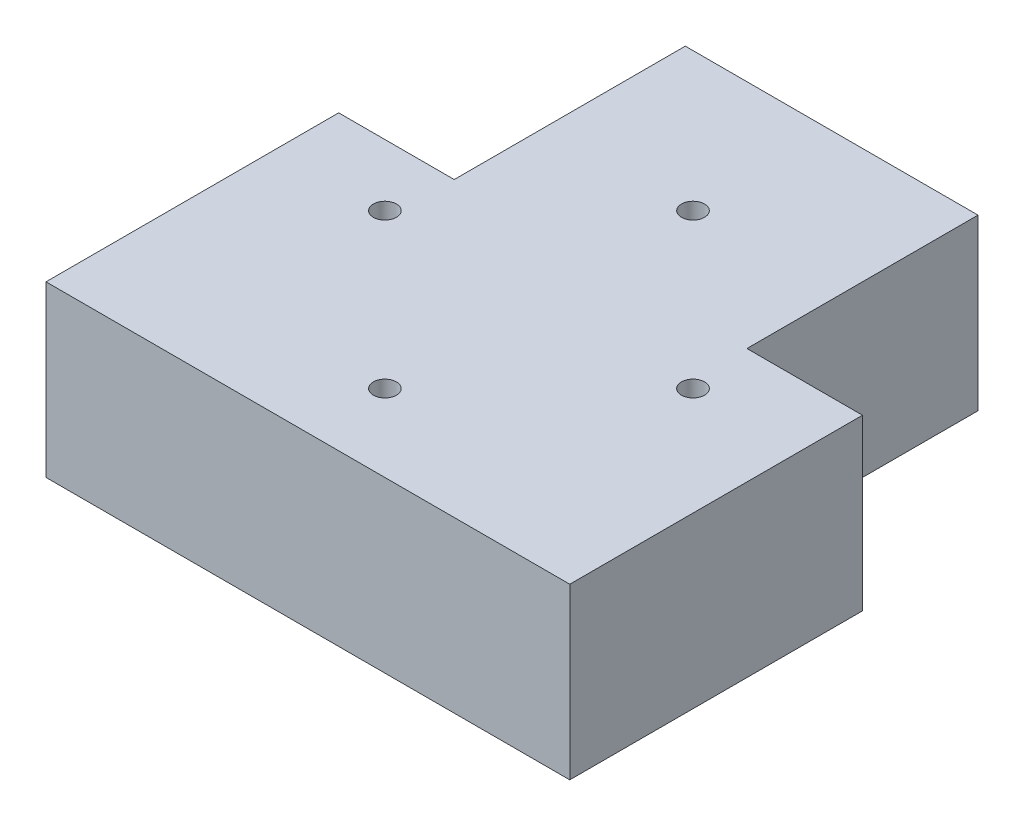
from build123d import *

# Parameters (mm, degrees)
CROQUIS3_R               = 11
SALIENTE_EXTRUIR1_DEPTH  = 6
CROQUIS5_R               = 1.7
CORTAR_EXTRUIR2_DEPTH    = 62.100641025
SALIENTE_EXTRUIR2_START  = -6
CROQUIS6_R               = 11
CROQUIS6_R_2             = 10.875
SALIENTE_EXTRUIR2_DEPTH  = 6
SALIENTE_EXTRUIR3_START  = -6
CROQUIS7_R               = 10.875
SALIENTE_EXTRUIR3_DEPTH  = 6
CROQUIS8_W               = 68
CROQUIS8_H               = 4
SALIENTE_EXTRUIR5_DEPTH  = 6
CROQUIS9_W               = 88.033568274
CROQUIS9_H               = 18.476688198
CORTAR_EXTRUIR3_DEPTH    = 6
CROQUIS10_W              = 21.550300015
CROQUIS10_H              = 64
CORTAR_EXTRUIR4_DEPTH    = 6
CROQUIS11_W              = 19.085610936
CROQUIS11_H              = 64
CORTAR_EXTRUIR5_DEPTH    = 6
CROQUIS12_W              = 103.706532793
CROQUIS12_H              = 25.59484813
CORTAR_EXTRUIR6_DEPTH    = 6
SALIENTE_EXTRUIR7_DEPTH  = 6
SALIENTE_EXTRUIR8_START  = -6
SALIENTE_EXTRUIR8_DEPTH  = 6
CROQUIS15_W              = 68
CROQUIS15_H              = 3
CORTAR_EXTRUIR7_DEPTH    = 90
SALIENTE_EXTRUIR9_DEPTH  = 15
CROQUIS17_W              = 15
CROQUIS17_H              = 30
CORTAR_EXTRUIR8_DEPTH    = 15
CROQUIS18_W              = 23.220677269
CROQUIS18_H              = 33.839021269
CORTAR_EXTRUIR10_DEPTH   = 15
CROQUIS19_R              = 1.5
SALIENTE_EXTRUIR10_DEPTH = 4
CROQUIS20_R              = 2.75
CORTAR_EXTRUIR12_DEPTH   = 4


with BuildPart() as part:
    # Croquis3 → Saliente-Extruir1 (new body)
    with BuildSketch(Plane(origin=(0, 0, 0), x_dir=(1, 0, 0), z_dir=(0, 1, 0))):
        with BuildLine():
            ThreePointArc((-42.801000552, 4.132112265), (-40.664966724, 3.179307113), (-38.41511618, 2.540049182))
            ThreePointArc((-38.41511618, 2.540049182), (-38.470748704, 1.474616944), (-38.496837459, 0.408052268))
            ThreePointArc((-38.496837459, 0.408052268), (-40.789021211, -0.057105575), (-42.991724013, -0.843603213))
            ThreePointArc((-42.991724013, -0.843603213), (-42.968445785, -1.647017549), (-42.930154943, -2.449856438))
            ThreePointArc((-42.930154943, -2.449856438), (-40.673709502, -3.065431082), (-38.352643988, -3.353759106))
            ThreePointArc((-38.352643988, -3.353759106), (-38.244987054, -4.415197194), (-38.107959725, -5.473244614))
            ThreePointArc((-38.107959725, -5.473244614), (-40.302274043, -6.282851213), (-42.3591038, -7.396372439))
            ThreePointArc((-42.3591038, -7.396372439), (-42.21345776, -8.186817694), (-42.053062888, -8.974402582))
            ThreePointArc((-42.053062888, -8.974402582), (-39.729095003, -9.238318171), (-37.391218326, -9.168958123))
            ThreePointArc((-37.391218326, -9.168958123), (-37.122795321, -10.201522853), (-36.825863714, -11.226253282))
            ThreePointArc((-36.825863714, -11.226253282), (-38.87087573, -12.361332145), (-40.733622096, -13.775776963))
            ThreePointArc((-40.733622096, -13.775776963), (-40.469022063, -14.534725772), (-40.190282682, -15.288596336))
            ThreePointArc((-40.190282682, -15.288596336), (-37.85326419, -15.194666912), (-35.553374199, -14.769244533))
            ThreePointArc((-35.553374199, -14.769244533), (-35.130476731, -15.748733462), (-34.680600669, -16.716128087))
            ThreePointArc((-34.680600669, -16.716128087), (-36.528377035, -18.150073928), (-38.153378814, -19.832288952))
            ThreePointArc((-38.153378814, -19.832288952), (-37.776026789, -20.541952196), (-37.385476313, -21.24443835))
            ThreePointArc((-37.385476313, -21.24443835), (-35.090184947, -20.794865539), (-32.882189114, -20.023352369))
            ThreePointArc((-32.882189114, -20.023352369), (-32.314729541, -20.926807107), (-31.722453739, -21.814191019))
            ThreePointArc((-31.722453739, -21.814191019), (-33.329684142, -23.513393361), (-34.67885267, -25.423948896))
            ThreePointArc((-34.67885267, -25.423948896), (-34.197593465, -26.067692672), (-33.704386066, -26.702328735))
            ThreePointArc((-33.704386066, -26.702328735), (-31.50462151, -25.907650142), (-29.440273385, -24.808129797))
            ThreePointArc((-29.440273385, -24.808129797), (-28.741552479, -25.614374131), (-28.020759379, -26.400947801))
            ThreePointArc((-28.020759379, -26.400947801), (-29.349771703, -28.325578783), (-30.391483612, -30.419693027))
            ThreePointArc((-30.391483612, -30.419693027), (-29.817597534, -30.982428525), (-29.233293577, -31.534339166))
            ThreePointArc((-29.233293577, -31.534339166), (-27.180616447, -30.413181385), (-25.308302601, -29.011425688))
            ThreePointArc((-25.308302601, -29.011425688), (-24.494697787, -29.701561934), (-23.66228217, -30.368888744))
            ThreePointArc((-23.66228217, -30.368888744), (-24.68192549, -32.473836646), (-25.391763937, -34.702425336))
            ThreePointArc((-25.391763937, -34.702425336), (-24.738702389, -35.170962513), (-24.076997462, -35.627211415))
            ThreePointArc((-24.076997462, -35.627211415), (-22.219520771, -34.205853433), (-20.583126654, -32.53471835))
            ThreePointArc((-20.583126654, -32.53471835), (-19.67370814, -33.092570299), (-18.749181121, -33.625008674))
            ThreePointArc((-18.749181121, -33.625008674), (-19.435555863, -35.860935301), (-19.796882836, -38.171762207))
            ThreePointArc((-19.796882836, -38.171762207), (-19.079953028, -38.535118949), (-18.356356934, -38.885012024))
            ThreePointArc((-18.356356934, -38.885012024), (-16.737618362, -37.196769268), (-15.375499664, -35.29542479))
            ThreePointArc((-15.375499664, -35.29542479), (-14.391583449, -35.707916865), (-13.396615158, -36.092986899))
            ThreePointArc((-13.396615158, -36.092986899), (-13.73363328, -38.407484027), (-13.73797958, -40.746385325))
            ThreePointArc((-13.73797958, -40.746385325), (-12.97398574, -40.996044858), (-12.205458958, -41.231380909))
            ThreePointArc((-12.205458958, -41.231380909), (-10.863400364, -39.315824358), (-9.807483994, -37.228836387))
            ThreePointArc((-9.807483994, -37.228836387), (-8.772132239, -37.486300124), (-7.73004389, -37.714976103))
            ThreePointArc((-7.73004389, -37.714976103), (-7.709805972, -40.053793881), (-7.357069727, -42.365947706))
            ThreePointArc((-7.357069727, -42.365947706), (-6.563919221, -42.496058223), (-5.768475368, -42.611321171))
            ThreePointArc((-5.768475368, -42.611321171), (-4.734553468, -40.513349847), (-4.009589211, -38.289635613))
            ThreePointArc((-4.009589211, -38.289635613), (-2.947069685, -38.38603628), (-1.882286945, -38.452958233))
            ThreePointArc((-1.882286945, -38.452958233), (-1.505267347, -40.761276754), (-0.803716395, -42.992488181))
            ThreePointArc((-0.803716395, -42.992488181), (0, -43), (0.803716395, -42.992488181))
            ThreePointArc((0.803716395, -42.992488181), (1.505267347, -40.761276754), (1.882286945, -38.452958233))
            ThreePointArc((1.882286945, -38.452958233), (2.947069685, -38.38603628), (4.009589211, -38.289635613))
            ThreePointArc((4.009589211, -38.289635613), (4.734553468, -40.513349847), (5.768475368, -42.611321171))
            ThreePointArc((5.768475368, -42.611321171), (6.563919221, -42.496058223), (7.357069727, -42.365947706))
            ThreePointArc((7.357069727, -42.365947706), (7.709805972, -40.053793881), (7.73004389, -37.714976103))
            ThreePointArc((7.73004389, -37.714976103), (8.772132239, -37.486300124), (9.807483994, -37.228836387))
            ThreePointArc((9.807483994, -37.228836387), (10.863400364, -39.315824358), (12.205458958, -41.231380909))
            ThreePointArc((12.205458958, -41.231380909), (12.97398574, -40.996044858), (13.73797958, -40.746385325))
            ThreePointArc((13.73797958, -40.746385325), (13.73363328, -38.407484027), (13.396615158, -36.092986899))
            ThreePointArc((13.396615158, -36.092986899), (14.391583449, -35.707916865), (15.375499664, -35.29542479))
            ThreePointArc((15.375499664, -35.29542479), (16.737618362, -37.196769268), (18.356356934, -38.885012024))
            ThreePointArc((18.356356934, -38.885012024), (19.079953028, -38.535118949), (19.796882836, -38.171762207))
            ThreePointArc((19.796882836, -38.171762207), (19.435555863, -35.860935301), (18.749181121, -33.625008674))
            ThreePointArc((18.749181121, -33.625008674), (19.67370814, -33.092570299), (20.583126654, -32.53471835))
            ThreePointArc((20.583126654, -32.53471835), (22.219520771, -34.205853433), (24.076997462, -35.627211415))
            ThreePointArc((24.076997462, -35.627211415), (24.738702389, -35.170962513), (25.391763937, -34.702425336))
            ThreePointArc((25.391763937, -34.702425336), (24.68192549, -32.473836646), (23.66228217, -30.368888744))
            ThreePointArc((23.66228217, -30.368888744), (24.494697787, -29.701561934), (25.308302601, -29.011425688))
            ThreePointArc((25.308302601, -29.011425688), (27.180616447, -30.413181385), (29.233293577, -31.534339166))
            ThreePointArc((29.233293577, -31.534339166), (29.817597534, -30.982428525), (30.391483612, -30.419693027))
            ThreePointArc((30.391483612, -30.419693027), (29.349771703, -28.325578783), (28.020759379, -26.400947801))
            ThreePointArc((28.020759379, -26.400947801), (28.741552479, -25.614374131), (29.440273385, -24.808129797))
            ThreePointArc((29.440273385, -24.808129797), (31.50462151, -25.907650142), (33.704386066, -26.702328735))
            ThreePointArc((33.704386066, -26.702328735), (34.197593465, -26.067692672), (34.67885267, -25.423948896))
            ThreePointArc((34.67885267, -25.423948896), (33.329684142, -23.513393361), (31.722453739, -21.814191019))
            ThreePointArc((31.722453739, -21.814191019), (32.314729541, -20.926807107), (32.882189114, -20.023352369))
            ThreePointArc((32.882189114, -20.023352369), (35.090184947, -20.794865539), (37.385476313, -21.24443835))
            ThreePointArc((37.385476313, -21.24443835), (37.776026789, -20.541952196), (38.153378814, -19.832288952))
            ThreePointArc((38.153378814, -19.832288952), (36.528377035, -18.150073928), (34.680600669, -16.716128087))
            ThreePointArc((34.680600669, -16.716128087), (35.130476731, -15.748733462), (35.553374199, -14.769244533))
            ThreePointArc((35.553374199, -14.769244533), (37.85326419, -15.194666912), (40.190282682, -15.288596336))
            ThreePointArc((40.190282682, -15.288596336), (40.469022063, -14.534725772), (40.733622096, -13.775776963))
            ThreePointArc((40.733622096, -13.775776963), (38.87087573, -12.361332145), (36.825863714, -11.226253282))
            ThreePointArc((36.825863714, -11.226253282), (37.122795321, -10.201522853), (37.391218326, -9.168958123))
            ThreePointArc((37.391218326, -9.168958123), (39.729095003, -9.238318171), (42.053062888, -8.974402582))
            ThreePointArc((42.053062888, -8.974402582), (42.21345776, -8.186817694), (42.3591038, -7.396372439))
            ThreePointArc((42.3591038, -7.396372439), (40.302274043, -6.282851213), (38.107959725, -5.473244614))
            ThreePointArc((38.107959725, -5.473244614), (38.244987054, -4.415197194), (38.352643988, -3.353759106))
            ThreePointArc((38.352643988, -3.353759106), (40.673709502, -3.065431082), (42.930154943, -2.449856438))
            ThreePointArc((42.930154943, -2.449856438), (42.968445785, -1.647017549), (42.991724013, -0.843603213))
            ThreePointArc((42.991724013, -0.843603213), (40.789021211, -0.057105575), (38.496837459, 0.408052268))
            ThreePointArc((38.496837459, 0.408052268), (38.470748704, 1.474616944), (38.41511618, 2.540049182))
            ThreePointArc((38.41511618, 2.540049182), (40.664966724, 3.179307113), (42.801000552, 4.132112265))
            ThreePointArc((42.801000552, 4.132112265), (42.71628986, 4.931387292), (42.616654653, 5.728939357))
            ThreePointArc((42.616654653, 5.728939357), (40.319708293, 6.16997857), (37.983381952, 6.279784751))
            ThreePointArc((37.983381952, 6.279784751), (37.794788612, 7.329867312), (37.577170609, 8.37432087))
            ThreePointArc((37.577170609, 8.37432087), (39.703071592, 9.349525044), (41.668626984, 10.617227758))
            ThreePointArc((41.668626984, 10.617227758), (41.462900304, 11.394204594), (41.242687029, 12.167200444))
            ThreePointArc((41.242687029, 12.167200444), (38.905335586, 12.252443647), (36.579628164, 12.004324402))
            ThreePointArc((36.579628164, 12.004324402), (36.232950707, 13.013311802), (35.858448007, 14.012305575))
            ThreePointArc((35.858448007, 14.012305575), (37.810570112, 15.300598033), (39.559576116, 16.853484432))
            ThreePointArc((39.559576116, 16.853484432), (39.237655508, 17.589951398), (38.902025776, 18.320272666))
            ThreePointArc((38.902025776, 18.320272666), (36.579054788, 18.047721829), (34.318478896, 17.447492864))
            ThreePointArc((34.318478896, 17.447492864), (33.821843148, 18.391735293), (33.299233776, 19.321853713))
            ThreePointArc((33.299233776, 19.321853713), (35.031820916, 20.893037971), (36.523282314, 22.694709714))
            ThreePointArc((36.523282314, 22.694709714), (36.092713324, 23.37340465), (35.64953401, 24.043933223))
            ThreePointArc((35.64953401, 24.043933223), (33.395391948, 23.419976708), (31.25293357, 22.48170688))
            ThreePointArc((31.25293357, 22.48170688), (30.617980251, 23.339072097), (29.959513729, 24.178513977))
            ThreePointArc((29.959513729, 24.178513977), (31.431955529, 25.995762808), (32.63091373, 28.003990237))
            ThreePointArc((32.63091373, 28.003990237), (32.101788529, 28.609005107), (31.561447383, 29.204024365))
            ThreePointArc((31.561447383, 29.204024365), (29.428969426, 28.243287183), (27.45484597, 26.988968742))
            ThreePointArc((27.45484597, 26.988968742), (26.696457848, 27.739360832), (25.917568072, 28.468450366))
            ThreePointArc((25.917568072, 28.468450366), (27.095351745, 30.489168998), (27.973704184, 32.656880963))
            ThreePointArc((27.973704184, 32.656880963), (27.35842502, 33.174034732), (26.733587179, 33.679597927))
            ThreePointArc((26.733587179, 33.679597927), (24.772756803, 32.404598945), (23.013240049, 30.863632052))
            ThreePointArc((23.013240049, 30.863632052), (22.1491931, 31.48946246), (21.268136586, 32.091110407))
            ThreePointArc((21.268136586, 32.091110407), (22.123655881, 34.267934907), (22.660814722, 36.544322078))
            ThreePointArc((22.660814722, 36.544322078), (21.973803216, 36.9614931), (21.27911435, 37.36575026))
            ThreePointArc((21.27911435, 37.36575026), (19.535891757, 35.806374372), (18.032223288, 34.014877985))
            ThreePointArc((18.032223288, 34.014877985), (17.082770038, 34.501477777), (16.120198005, 34.961582019))
            ThreePointArc((16.120198005, 34.961582019), (16.633400275, 37.243489467), (16.816774969, 39.575195257))
            ThreePointArc((16.816774969, 39.575195257), (16.074134089, 39.882605397), (15.325877117, 40.176081076))
            ThreePointArc((15.325877117, 40.176081076), (13.841121966, 38.368878731), (12.628546495, 36.368844007))
            ThreePointArc((12.628546495, 36.368844007), (11.615941325, 36.704807698), (10.594415646, 37.012583781))
            ThreePointArc((10.594415646, 37.012583781), (10.753271864, 39.3460882), (10.578564264, 41.678459402))
            ThreePointArc((10.578564264, 41.678459402), (9.797700883, 41.868903227), (9.013414313, 42.044718603))
            ThreePointArc((9.013414313, 42.044718603), (7.821928008, 40.032049093), (6.928867276, 37.870355151))
            ThreePointArc((6.928867276, 37.870355151), (5.876844793, 38.047808035), (4.820309163, 38.196041949))
            ThreePointArc((4.820309163, 38.196041949), (4.621095874, 40.526447973), (4.092400979, 42.804815783))
            ThreePointArc((4.092400979, 42.804815783), (3.291617872, 42.873829451), (2.489684717, 42.927863562))
            ThreePointArc((2.489684717, 42.927863562), (1.619394686, 40.756902154), (1.066781281, 38.484217268))
            ThreePointArc((1.066781281, 38.484217268), (0, 38.499), (-1.066781281, 38.484217268))
            ThreePointArc((-1.066781281, 38.484217268), (-1.619394686, 40.756902154), (-2.489684717, 42.927863562))
            ThreePointArc((-2.489684717, 42.927863562), (-3.291617872, 42.873829451), (-4.092400979, 42.804815783))
            ThreePointArc((-4.092400979, 42.804815783), (-4.621095874, 40.526447973), (-4.820309163, 38.196041949))
            ThreePointArc((-4.820309163, 38.196041949), (-5.876844793, 38.047808035), (-6.928867276, 37.870355151))
            ThreePointArc((-6.928867276, 37.870355151), (-7.821928008, 40.032049093), (-9.013414313, 42.044718603))
            ThreePointArc((-9.013414313, 42.044718603), (-9.797700883, 41.868903227), (-10.578564264, 41.678459402))
            ThreePointArc((-10.578564264, 41.678459402), (-10.753271864, 39.3460882), (-10.594415646, 37.012583781))
            ThreePointArc((-10.594415646, 37.012583781), (-11.615941325, 36.704807698), (-12.628546495, 36.368844007))
            ThreePointArc((-12.628546495, 36.368844007), (-13.841121966, 38.368878731), (-15.325877117, 40.176081076))
            ThreePointArc((-15.325877117, 40.176081076), (-16.074134089, 39.882605397), (-16.816774969, 39.575195257))
            ThreePointArc((-16.816774969, 39.575195257), (-16.633400275, 37.243489467), (-16.120198005, 34.961582019))
            ThreePointArc((-16.120198005, 34.961582019), (-17.082770038, 34.501477777), (-18.032223288, 34.014877985))
            ThreePointArc((-18.032223288, 34.014877985), (-19.535891757, 35.806374372), (-21.27911435, 37.36575026))
            ThreePointArc((-21.27911435, 37.36575026), (-21.973803216, 36.9614931), (-22.660814722, 36.544322078))
            ThreePointArc((-22.660814722, 36.544322078), (-22.123655881, 34.267934907), (-21.268136586, 32.091110407))
            ThreePointArc((-21.268136586, 32.091110407), (-22.1491931, 31.48946246), (-23.013240049, 30.863632052))
            ThreePointArc((-23.013240049, 30.863632052), (-24.772756803, 32.404598945), (-26.733587179, 33.679597927))
            ThreePointArc((-26.733587179, 33.679597927), (-27.35842502, 33.174034732), (-27.973704184, 32.656880963))
            ThreePointArc((-27.973704184, 32.656880963), (-27.095351745, 30.489168998), (-25.917568072, 28.468450366))
            ThreePointArc((-25.917568072, 28.468450366), (-26.696457848, 27.739360832), (-27.45484597, 26.988968742))
            ThreePointArc((-27.45484597, 26.988968742), (-29.428969426, 28.243287183), (-31.561447383, 29.204024364))
            ThreePointArc((-31.561447383, 29.204024364), (-32.101788529, 28.609005107), (-32.63091373, 28.003990237))
            ThreePointArc((-32.63091373, 28.003990237), (-31.431955529, 25.995762808), (-29.959513729, 24.178513977))
            ThreePointArc((-29.959513729, 24.178513977), (-30.617980251, 23.339072097), (-31.25293357, 22.48170688))
            ThreePointArc((-31.25293357, 22.48170688), (-33.395391948, 23.419976708), (-35.64953401, 24.043933223))
            ThreePointArc((-35.64953401, 24.043933223), (-36.092713324, 23.37340465), (-36.523282314, 22.694709714))
            ThreePointArc((-36.523282314, 22.694709714), (-35.031820916, 20.893037971), (-33.299233776, 19.321853713))
            ThreePointArc((-33.299233776, 19.321853713), (-33.821843148, 18.391735293), (-34.318478896, 17.447492864))
            ThreePointArc((-34.318478896, 17.447492864), (-36.579054788, 18.047721829), (-38.902025776, 18.320272666))
            ThreePointArc((-38.902025776, 18.320272666), (-39.237655508, 17.589951398), (-39.559576116, 16.853484432))
            ThreePointArc((-39.559576116, 16.853484432), (-37.810570112, 15.300598033), (-35.858448007, 14.012305575))
            ThreePointArc((-35.858448007, 14.012305575), (-36.232950707, 13.013311802), (-36.579628164, 12.004324402))
            ThreePointArc((-36.579628164, 12.004324402), (-38.905335586, 12.252443647), (-41.242687029, 12.167200444))
            ThreePointArc((-41.242687029, 12.167200444), (-41.462900304, 11.394204594), (-41.668626984, 10.617227758))
            ThreePointArc((-41.668626984, 10.617227758), (-39.703071592, 9.349525044), (-37.577170609, 8.37432087))
            ThreePointArc((-37.577170609, 8.37432087), (-37.794788612, 7.329867312), (-37.983381952, 6.279784751))
            ThreePointArc((-37.983381952, 6.279784751), (-40.319708293, 6.16997857), (-42.616654653, 5.728939357))
            ThreePointArc((-42.616654653, 5.728939357), (-42.71628986, 4.931387292), (-42.801000552, 4.132112265))
        make_face()
        with Locations(Location((0, 0, 0), (0, 0, 270))):
            Circle(CROQUIS3_R, mode=Mode.SUBTRACT)
    extrude(amount=SALIENTE_EXTRUIR1_DEPTH)

    # Croquis5 → Cortar-Extruir2 (cut, through all)
    with BuildSketch(Plane(origin=(0, 6, 0), x_dir=(1, 0, 0), z_dir=(0, 1, 0))):
        with Locations(Location((0, 20, 0), (0, 0, 270))):
            Circle(CROQUIS5_R)
        with Locations(Location((20, 0, 0), (0, 0, 270))):
            Circle(CROQUIS5_R)
        with Locations(Location((0, -20, 0), (0, 0, 270))):
            Circle(CROQUIS5_R)
        with Locations(Location((-20, 0, 0), (0, 0, 270))):
            Circle(CROQUIS5_R)
    extrude(amount=-CORTAR_EXTRUIR2_DEPTH, mode=Mode.SUBTRACT)

    # Croquis6 → Saliente-Extruir2 (add)
    with BuildSketch(Plane(origin=(0, 6, 0), x_dir=(1, 0, 0), z_dir=(0, 1, 0)).offset(SALIENTE_EXTRUIR2_START)):
        Circle(CROQUIS6_R)
        with Locations(Location((0, 0, 0), (0, 0, 270))):
            Circle(CROQUIS6_R_2, mode=Mode.SUBTRACT)
    extrude(amount=SALIENTE_EXTRUIR2_DEPTH)

    # Croquis7 → Saliente-Extruir3 (add)
    with BuildSketch(Plane(origin=(0, 6, 0), x_dir=(1, 0, 0), z_dir=(0, 1, 0)).offset(SALIENTE_EXTRUIR3_START)):
        Circle(CROQUIS7_R)
    extrude(amount=SALIENTE_EXTRUIR3_DEPTH)

    # Croquis8 → Saliente-Extruir5 (add)
    with BuildSketch(Plane(origin=(0, 6, 0), x_dir=(1, 0, 0), z_dir=(0, 1, 0))):
        with Locations((0, -28)):
            Rectangle(CROQUIS8_W, CROQUIS8_H)
    extrude(amount=-SALIENTE_EXTRUIR5_DEPTH)

    # Croquis9 → Cortar-Extruir3 (cut)
    with BuildSketch(Plane(origin=(0, 6, 0), x_dir=(1, 0, 0), z_dir=(0, 1, 0))):
        with Locations((10.016784137, -39.238344099)):
            Rectangle(CROQUIS9_W, CROQUIS9_H)
    extrude(amount=-CORTAR_EXTRUIR3_DEPTH, mode=Mode.SUBTRACT)

    # Croquis10 → Cortar-Extruir4 (cut)
    with BuildSketch(Plane(origin=(0, 6, 0), x_dir=(1, 0, 0), z_dir=(0, 1, 0))):
        with Locations((-44.775150008, 2)):
            Rectangle(CROQUIS10_W, CROQUIS10_H)
    extrude(amount=-CORTAR_EXTRUIR4_DEPTH, mode=Mode.SUBTRACT)

    # Croquis11 → Cortar-Extruir5 (cut)
    with BuildSketch(Plane(origin=(0, 6, 0), x_dir=(1, 0, 0), z_dir=(0, 1, 0))):
        with Locations((43.542805468, 2)):
            Rectangle(CROQUIS11_W, CROQUIS11_H)
    extrude(amount=-CORTAR_EXTRUIR5_DEPTH, mode=Mode.SUBTRACT)

    # Croquis12 → Cortar-Extruir6 (cut)
    with BuildSketch(Plane(origin=(0, 6, 0), x_dir=(1, 0, 0), z_dir=(0, 1, 0))):
        with Locations((2.74907628, 50.797424065)):
            Rectangle(CROQUIS12_W, CROQUIS12_H)
    extrude(amount=-CORTAR_EXTRUIR6_DEPTH, mode=Mode.SUBTRACT)

    # Croquis13 → Saliente-Extruir7 (add)
    with BuildSketch(Plane(origin=(0, 6, 0), x_dir=(1, 0, 0), z_dir=(0, 1, 0))):
        Polygon((-34, 38), (-34, 14.467679055), (-4.360603755, 38), align=None)
    extrude(amount=-SALIENTE_EXTRUIR7_DEPTH)

    # Croquis14 → Saliente-Extruir8 (add)
    with BuildSketch(Plane(origin=(0, 6, 0), x_dir=(1, 0, 0), z_dir=(0, 1, 0)).offset(SALIENTE_EXTRUIR8_START)):
        with BuildLine():
            ThreePointArc((-29.440273385, -24.808129797), (-28.922869663, -25.409459094), (-28.39318582, -26))
            Line((-28.39318582, -26), (-31.716526987, -26))
            ThreePointArc((-31.716526987, -26), (-30.555022748, -25.448711519), (-29.440273385, -24.808129797))
        make_face()
        with BuildLine():
            ThreePointArc((-32.882189114, -20.023352369), (-33.437118608, -20.250964276), (-34, -20.458131994))
            Line((-34, -20.458131994), (-34, -24.390483775))
            ThreePointArc((-34, -24.390483775), (-32.928936598, -23.042479278), (-31.722453739, -21.814191019))
            ThreePointArc((-31.722453739, -21.814191019), (-32.314729541, -20.926807107), (-32.882189114, -20.023352369))
        make_face()
        with BuildLine():
            ThreePointArc((31.722453739, -21.814191019), (32.928936598, -23.042479278), (34, -24.390483775))
            Line((34, -24.390483775), (34, -20.458131994))
            ThreePointArc((34, -20.458131994), (33.437118608, -20.250964276), (32.882189114, -20.023352369))
            ThreePointArc((32.882189114, -20.023352369), (32.314729541, -20.926807107), (31.722453739, -21.814191019))
        make_face()
        with BuildLine():
            ThreePointArc((29.440273385, -24.808129797), (30.555022748, -25.448711519), (31.716526987, -26))
            Line((31.716526987, -26), (28.39318582, -26))
            ThreePointArc((28.39318582, -26), (28.922869663, -25.409459094), (29.440273385, -24.808129797))
        make_face()
        with BuildLine():
            ThreePointArc((31.25293357, 22.48170688), (32.600571454, 23.114088848), (34, 23.621665997))
            Line((34, 23.621665997), (34, 38))
            Line((34, 38), (16.729688427, 38))
            ThreePointArc((16.729688427, 38), (16.496871557, 36.466362568), (16.120198005, 34.961582019))
            ThreePointArc((16.120198005, 34.961582019), (17.082770038, 34.501477777), (18.032223288, 34.014877985))
            ThreePointArc((18.032223288, 34.014877985), (19.535891757, 35.806374372), (21.27911435, 37.36575026))
            ThreePointArc((21.27911435, 37.36575026), (21.973803216, 36.9614931), (22.660814722, 36.544322078))
            ThreePointArc((22.660814722, 36.544322078), (22.123655881, 34.267934907), (21.268136586, 32.091110407))
            ThreePointArc((21.268136586, 32.091110407), (22.1491931, 31.48946246), (23.013240049, 30.863632052))
            ThreePointArc((23.013240049, 30.863632052), (24.772756803, 32.404598945), (26.733587179, 33.679597927))
            ThreePointArc((26.733587179, 33.679597927), (27.35842502, 33.174034732), (27.973704184, 32.656880963))
            ThreePointArc((27.973704184, 32.656880963), (27.095351745, 30.489168998), (25.917568072, 28.468450366))
            ThreePointArc((25.917568072, 28.468450366), (26.696457848, 27.739360832), (27.45484597, 26.988968742))
            ThreePointArc((27.45484597, 26.988968742), (29.428969426, 28.243287183), (31.561447383, 29.204024365))
            ThreePointArc((31.561447383, 29.204024365), (32.101788529, 28.609005107), (32.63091373, 28.003990237))
            ThreePointArc((32.63091373, 28.003990237), (31.431955529, 25.995762808), (29.959513729, 24.178513977))
            ThreePointArc((29.959513729, 24.178513977), (30.617980251, 23.339072097), (31.25293357, 22.48170688))
        make_face()
        with BuildLine():
            Line((6.972489556, 38), (6.178430302, 38))
            ThreePointArc((6.178430302, 38), (6.553969362, 37.937033181), (6.928867276, 37.870355151))
            ThreePointArc((6.928867276, 37.870355151), (6.95054325, 37.935223056), (6.972489556, 38))
        make_face()
        with BuildLine():
            Line((13.587272636, 38), (10.70252361, 38))
            ThreePointArc((10.70252361, 38), (10.655947082, 37.505473216), (10.594415646, 37.012583781))
            ThreePointArc((10.594415646, 37.012583781), (11.615941325, 36.704807698), (12.628546495, 36.368844007))
            ThreePointArc((12.628546495, 36.368844007), (13.084366971, 37.198259369), (13.587272636, 38))
        make_face()
        with BuildLine():
            ThreePointArc((33.299233776, 19.321853713), (33.655528836, 18.694340849), (34, 18.060260269))
            Line((34, 18.060260269), (34, 19.90375037))
            ThreePointArc((34, 19.90375037), (33.65365753, 19.60793598), (33.299233776, 19.321853713))
        make_face()
    extrude(amount=SALIENTE_EXTRUIR8_DEPTH)

    # Croquis15 → Cortar-Extruir7 (cut)
    with BuildSketch(Plane.ZY.offset(34)):
        with Locations((-4, 1.5)):
            Rectangle(CROQUIS15_W, CROQUIS15_H)
    extrude(amount=-CORTAR_EXTRUIR7_DEPTH, mode=Mode.SUBTRACT)

    # Croquis16 → Saliente-Extruir9 (add)
    with BuildSketch(Plane(origin=(0, 3, 0), x_dir=(-1, 0, 0), z_dir=(0, -1, 0))):
        Polygon((34, -30), (34, 8), (19, 8), (19, 38), (-19, 38), (-19, 8), (-34, 8), (-34, -30), align=None)
        Polygon((30, -26), (30, 4), (15, 4), (15, 34), (-15, 34), (-15, 4), (-30, 4), (-30, -26), align=None, mode=Mode.SUBTRACT)
    extrude(amount=SALIENTE_EXTRUIR9_DEPTH)

    # Croquis17 → Cortar-Extruir8 (cut)
    with BuildSketch(Plane(origin=(0, 3, 0), x_dir=(-1, 0, 0), z_dir=(0, -1, 0))):
        with Locations((26.5, 23)):
            Rectangle(CROQUIS17_W, CROQUIS17_H)
    extrude(amount=-CORTAR_EXTRUIR8_DEPTH, mode=Mode.SUBTRACT)

    # Croquis18 → Cortar-Extruir10 (cut)
    with BuildSketch(Plane(origin=(0, 3, 0), x_dir=(-1, 0, 0), z_dir=(0, -1, 0))):
        with Locations((-30.610338634, 24.919510634)):
            Rectangle(CROQUIS18_W, CROQUIS18_H)
    extrude(amount=-CORTAR_EXTRUIR10_DEPTH, mode=Mode.SUBTRACT)

    # Croquis19 → Saliente-Extruir10 (add)
    with BuildSketch(Plane(origin=(0, 6, 0), x_dir=(1, 0, 0), z_dir=(0, 1, 0))):
        Polygon((-34, -30), (-34, 8), (-19, 8), (-19, 38), (19, 38), (19, 8), (34, 8), (34, -30), align=None)
        with Locations(Location((-20, 0, 0), (0, 0, 270))):
            Circle(CROQUIS19_R, mode=Mode.SUBTRACT)
        with Locations(Location((0, -20, 0), (0, 0, 270))):
            Circle(CROQUIS19_R, mode=Mode.SUBTRACT)
        with Locations(Location((20, 0, 0), (0, 0, 270))):
            Circle(CROQUIS19_R, mode=Mode.SUBTRACT)
        with Locations(Location((0, 20, 0), (0, 0, 270))):
            Circle(CROQUIS19_R, mode=Mode.SUBTRACT)
    extrude(amount=SALIENTE_EXTRUIR10_DEPTH)

    # Croquis20 → Cortar-Extruir12 (cut)
    with BuildSketch(Plane(origin=(0, 3, 0), x_dir=(-1, 0, 0), z_dir=(0, -1, 0))):
        with Locations(Location((0, -20, 0), (0, 0, 90))):
            Circle(CROQUIS20_R)
        with Locations(Location((-20, 0, 0), (0, 0, 90))):
            Circle(CROQUIS20_R)
        with Locations(Location((0, 20, 0), (0, 0, 90))):
            Circle(CROQUIS20_R)
        with Locations(Location((20, 0, 0), (0, 0, 90))):
            Circle(CROQUIS20_R)
    extrude(amount=-CORTAR_EXTRUIR12_DEPTH, mode=Mode.SUBTRACT)


solid = part.part
